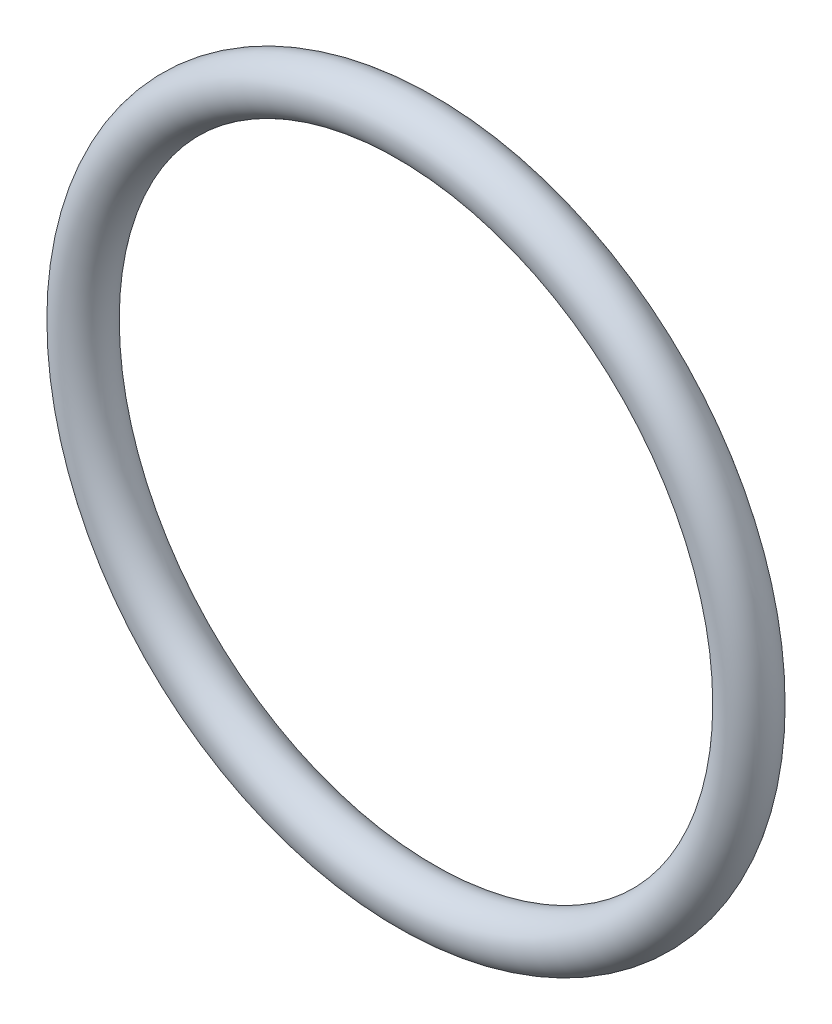
from build123d import *

# Parameters (mm, degrees)
SKETCH2_R = 0.79375


with BuildPart() as part:
    # Sketch2 → Revolve1 (revolve)
    with BuildSketch(Plane(origin=(0, 0, 0), x_dir=(1, 0, 0), z_dir=(0, 1, 0))):
        with Locations((-10.31875, 0)):
            Circle(SKETCH2_R)
    revolve(axis=Axis((0, 0, -11.796476064), (0, 0, 1)))


solid = part.part
